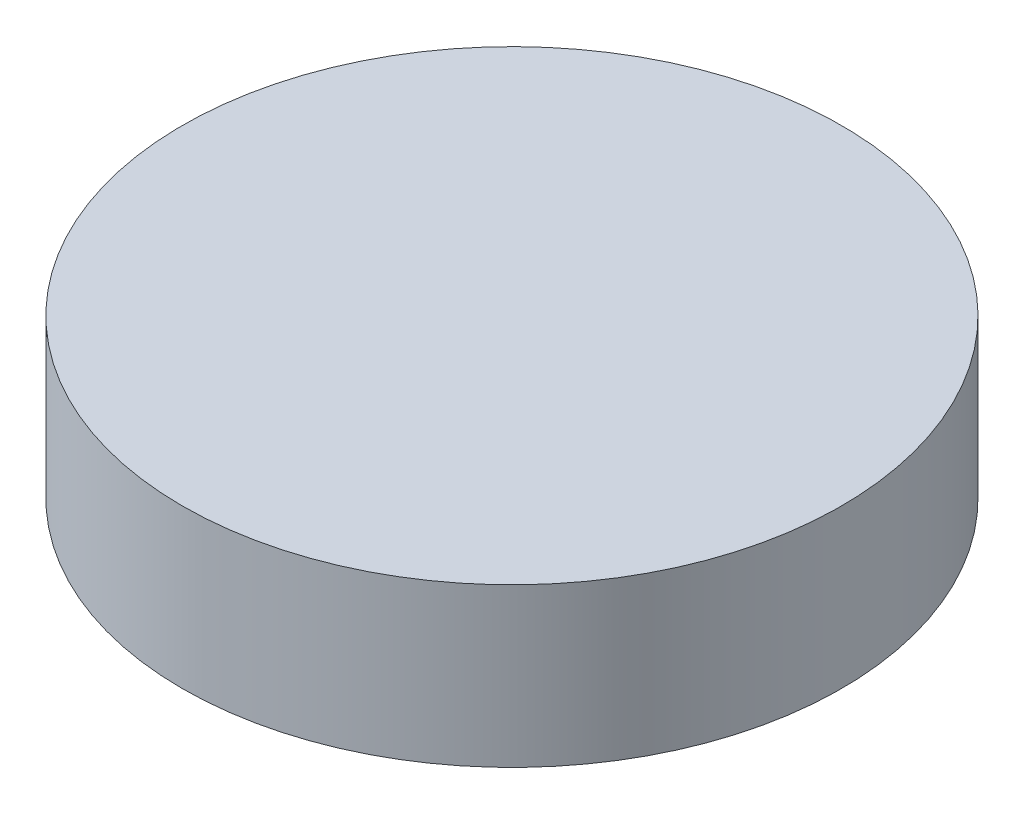
from build123d import *

# Parameters (mm, degrees)
SKETCH1_R                  = 25
TOPPING_AYAR_AYAGI_2_DEPTH = 12


with BuildPart() as part:
    # Sketch1 → TOPPING_ayar_ayagi_2 (new body)
    with BuildSketch(Plane(origin=(0, 0, 0), x_dir=(1, 0, 0), z_dir=(0, 1, 0))):
        with Locations(Location((650, 50, 0), (0, 0, 270))):
            Circle(SKETCH1_R)
    extrude(amount=TOPPING_AYAR_AYAGI_2_DEPTH)


solid = part.part
